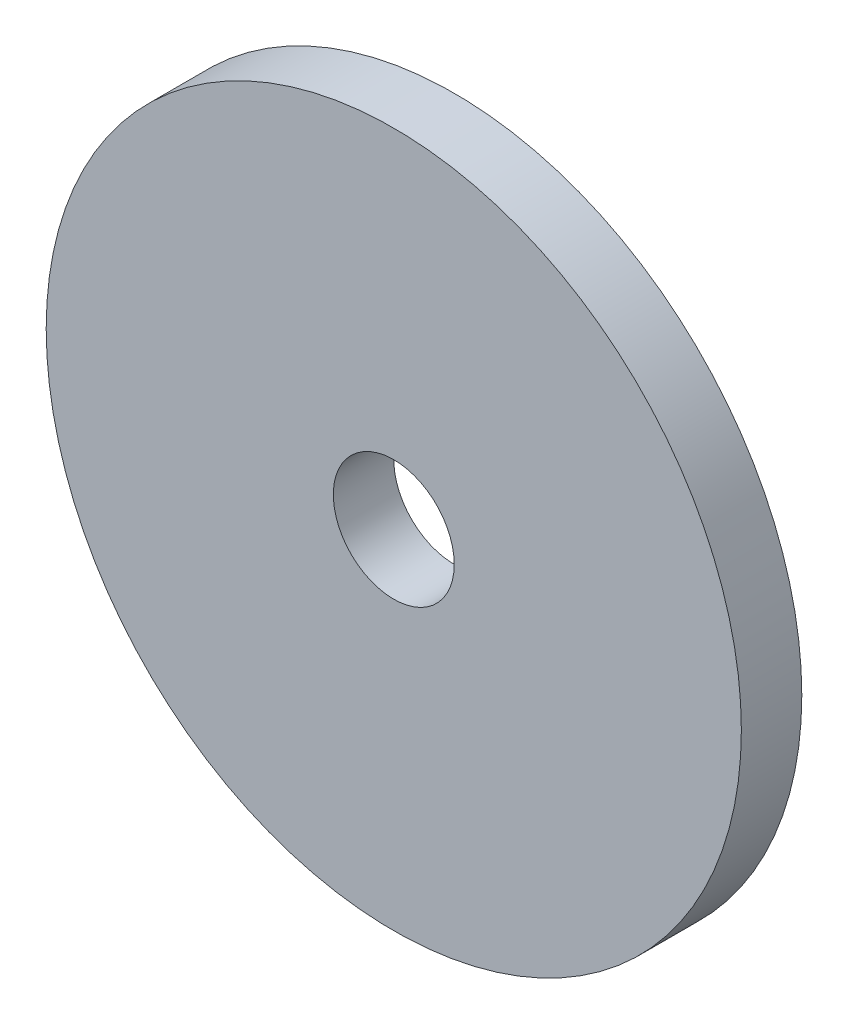
from build123d import *

# Parameters (mm, degrees)
SKETCH1_R           = 5.75
SKETCH1_R_2         = 1
BOSS_EXTRUDE1_DEPTH = 0.5


with BuildPart() as part:
    # Sketch1 → Boss-Extrude1 (new, symmetric)
    with BuildSketch(Plane.XY):
        Circle(SKETCH1_R)
        Circle(SKETCH1_R_2, mode=Mode.SUBTRACT)
    extrude(amount=BOSS_EXTRUDE1_DEPTH, both=True)


solid = part.part
